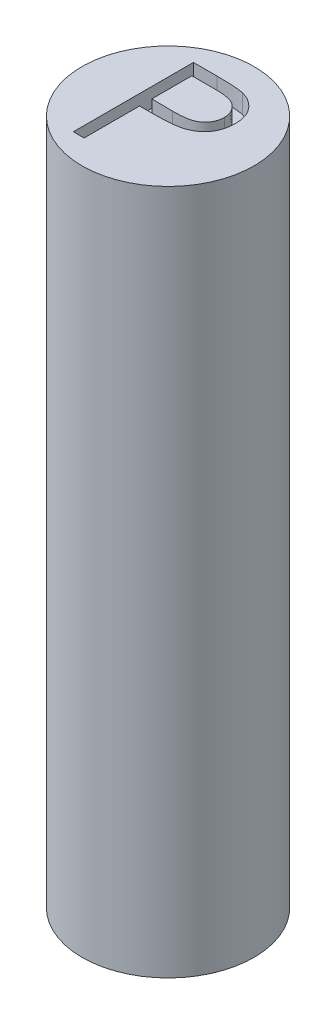
from build123d import *

# Parameters (mm, degrees)
SKETCH1_R           = 9.1
BOSS_EXTRUDE1_DEPTH = 72.5
CUT_EXTRUDE2_DEPTH  = 2


with BuildPart() as part:
    # Sketch1 → Boss-Extrude1 (new body)
    with BuildSketch(Plane(origin=(0, 0, 0), x_dir=(1, 0, 0), z_dir=(0, 1, 0))):
        with Locations(Location((0, 0, 0), (0, 0, 270))):
            Circle(SKETCH1_R)
    extrude(amount=BOSS_EXTRUDE1_DEPTH)

    # Sketch3 → Cut-Extrude2 (cut)
    with BuildSketch(Plane(origin=(0, 72.5, 0), x_dir=(1, 0, 0), z_dir=(0, 1, 0))):
        with BuildLine():
            Line((-3.582051282, 6.265328291), (-1.09140625, 6.265328291))
            add(Edge.make_bspline(
                [(-1.09140625, 6.265328291), (-0.920098105, 6.265139982), (-0.591864091, 6.264779173), (-0.121183746, 6.253839953), (0.30629728, 6.239228813), (0.689657234, 6.218974515), (1.030075647, 6.195038316), (1.326012134, 6.16146663), (1.57979281, 6.126413557), (1.731853355, 6.090775882), (1.801201923, 6.074523003)],
                knots=[0, 0, 0, 0, 1.415646017, 2.712440637, 3.8905458, 4.950247383, 5.884950622, 6.709939814, 7.411656543, 8, 8, 8, 8], degree=3))
            add(Edge.make_bspline(
                [(1.801201923, 6.074523003), (1.888989889, 6.050494785), (2.062497206, 6.003004544), (2.312509562, 5.907886176), (2.550376373, 5.795102319), (2.776913742, 5.666564023), (2.989337872, 5.516756405), (3.190818078, 5.351752134), (3.379576292, 5.167741586), (3.554551057, 4.966788615), (3.715241608, 4.752266711), (3.853597886, 4.520973477), (3.969448109, 4.276802176), (4.068810266, 4.019922646), (4.140323801, 3.748177758), (4.194196837, 3.463455687), (4.228391143, 3.165786954), (4.231666153, 2.962369721), (4.233333333, 2.858817875)],
                knots=[0, 0, 0, 0, 0.999701418, 1.975846123, 2.934577507, 3.890451536, 4.834027766, 5.787354733, 6.749476667, 7.726910423, 8.712836071, 9.690891519, 10.682875813, 11.679750201, 12.712814741, 13.765529915, 14.8625177, 16, 16, 16, 16], degree=3))
            add(Edge.make_bspline(
                [(4.233333333, 2.858817875), (4.231804164, 2.754395656), (4.22881224, 2.550086532), (4.192902862, 2.251190987), (4.144533309, 1.965555685), (4.070158291, 1.693813965), (3.972746848, 1.437579598), (3.858475685, 1.192936842), (3.720649732, 0.964047747), (3.56228135, 0.750081349), (3.386108422, 0.55083681), (3.192876332, 0.367757984), (2.983365185, 0.201916527), (2.758240819, 0.052940652), (2.51530851, -0.075714991), (2.258252696, -0.19094864), (1.984839053, -0.287726489), (1.795636217, -0.338635569), (1.699439103, -0.364519465)],
                knots=[0, 0, 0, 0, 1.121902311, 2.195077645, 3.232258892, 4.234102512, 5.217864754, 6.176164875, 7.132989551, 8.084763148, 9.034132444, 9.988522005, 10.94243251, 11.903244335, 12.886203696, 13.894208494, 14.929344452, 16, 16, 16, 16], degree=3))
            add(Edge.make_bspline(
                [(1.699439103, -0.364519465), (1.619874205, -0.381439425), (1.445503106, -0.418520501), (1.158328085, -0.459916902), (0.823971971, -0.495250481), (0.442891126, -0.52174318), (0.015427614, -0.544423089), (-0.458649805, -0.562450172), (-0.980271743, -0.572355642), (-1.344113114, -0.572866519), (-1.534074519, -0.573133247)],
                knots=[0, 0, 0, 0, 0.601384939, 1.31797006, 2.144135048, 3.087295005, 4.142315834, 5.309527816, 6.595305764, 8, 8, 8, 8], degree=3))
            Line((-1.534074519, -0.573133247), (-2.442307692, -0.573133247))
            Line((-2.442307692, -0.573133247), (-2.442307692, -6.434671709))
            Line((-2.442307692, -6.434671709), (-3.582051282, -6.434671709))
            Line((-3.582051282, -6.434671709), (-3.582051282, 6.265328291))
        make_face()
        with BuildLine():
            Line((-2.442307692, 4.962764189), (-2.442307692, 0.729430855))
            Line((-2.442307692, 0.729430855), (-0.218790064, 0.70144608))
            add(Edge.make_bspline(
                [(-0.218790064, 0.70144608), (-0.110223476, 0.701389969), (0.099362084, 0.701281648), (0.402116379, 0.715742316), (0.683001508, 0.732435678), (0.941154681, 0.756877457), (1.176692272, 0.79142602), (1.39000702, 0.826302898), (1.579444875, 0.876759499), (1.801147692, 0.944697493), (2.048192982, 1.06056727), (2.316952372, 1.228751156), (2.544719928, 1.443129726), (2.741817748, 1.684167857), (2.898230505, 1.952316127), (3.012733677, 2.239223411), (3.080011591, 2.541947322), (3.089032922, 2.749095712), (3.093589744, 2.853729734)],
                knots=[0, 0, 0, 0, 1.160613943, 2.240541288, 3.23993089, 4.169200891, 5.011653406, 5.7853311, 6.478053781, 7.106038997, 8.262395093, 9.384106736, 10.481365981, 11.59014053, 12.70357646, 13.786202915, 14.881775077, 16, 16, 16, 16], degree=3))
            add(Edge.make_bspline(
                [(3.093589744, 2.853729734), (3.089008141, 2.955832339), (3.079900481, 3.158799683), (3.012206349, 3.456265472), (2.898453124, 3.740149313), (2.740767767, 4.004937366), (2.54939281, 4.245108169), (2.326963765, 4.453740601), (2.074004216, 4.621459351), (1.838697778, 4.729711545), (1.62968776, 4.795806973), (1.44814322, 4.842052537), (1.243162773, 4.878975451), (1.014679687, 4.908873075), (0.76446489, 4.934467063), (0.490368719, 4.951833323), (0.193429499, 4.961998607), (-0.012711715, 4.962502816), (-0.119571314, 4.962764189)],
                knots=[0, 0, 0, 0, 1.120700087, 2.227813068, 3.331159281, 4.466773991, 5.599788987, 6.693661531, 7.80175334, 8.91857717, 9.525282508, 10.207424825, 10.974604443, 11.810962634, 12.737642355, 13.736264703, 14.826523623, 16, 16, 16, 16], degree=3))
            Line((-0.119571314, 4.962764189), (-2.442307692, 4.962764189))
        make_face(mode=Mode.SUBTRACT)
    extrude(amount=-CUT_EXTRUDE2_DEPTH, mode=Mode.SUBTRACT)


solid = part.part
